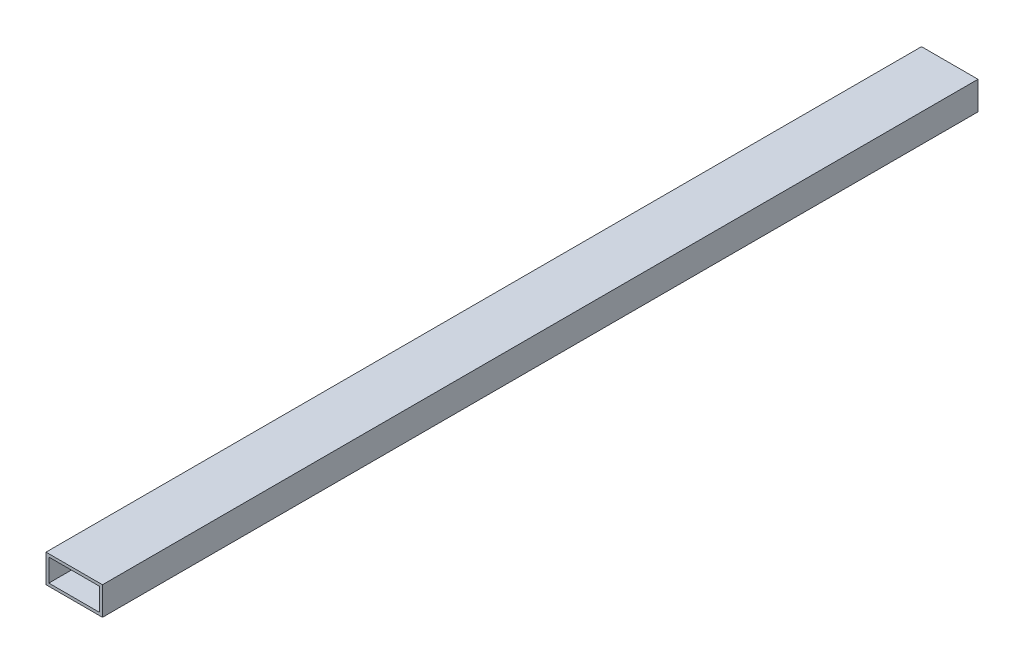
from build123d import *

# Parameters (mm, degrees)
SKETCH_1_W      = 40
SKETCH_1_H      = 20
SKETCH_1_W_2    = 36
SKETCH_1_H_2    = 16
EXTRUDE_1_DEPTH = 620


with BuildPart() as part:
    # Эскиз1 → Бобышка-Вытянуть1 (new body)
    with BuildSketch(Plane.XY):
        with Locations((-24.382722604, 1.111400901)):
            Rectangle(SKETCH_1_W, SKETCH_1_H)
        with Locations((-24.382722604, 1.111400901)):
            Rectangle(SKETCH_1_W_2, SKETCH_1_H_2, mode=Mode.SUBTRACT)
    extrude(amount=EXTRUDE_1_DEPTH)


solid = part.part
